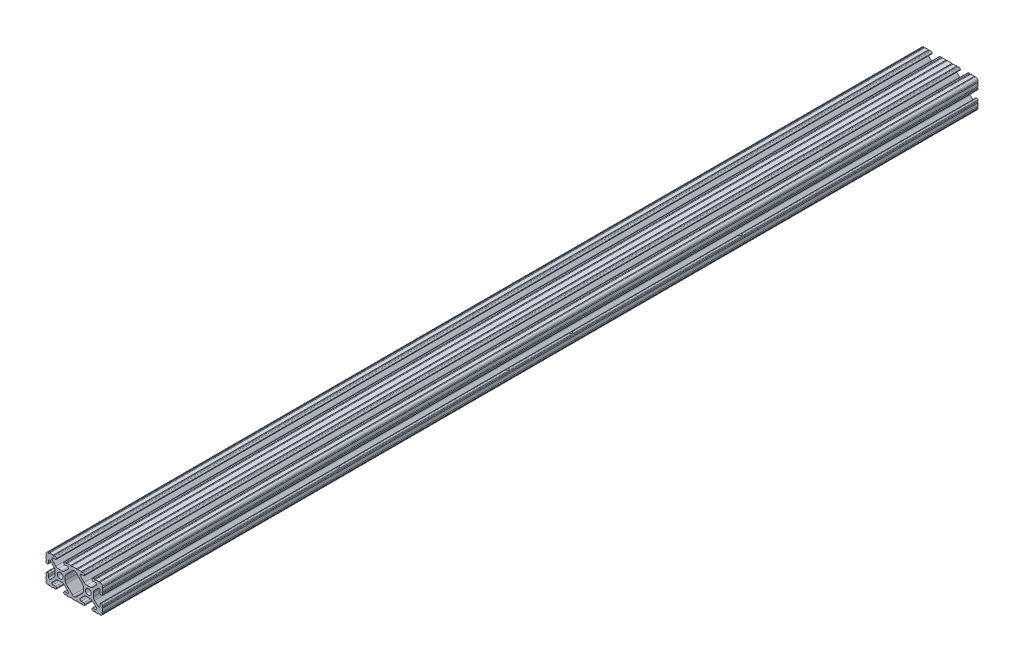
from build123d import *

# Parameters (mm, degrees)
SKETCH1_R               = 2.6035
BOSS_EXTRUDE1_DEPTH     = 393.7
CUT_EXTRUDE1_DEPTH      = 397.202554803
CUT_EXTRUDE1_DEPTH_BACK = 397.202554803
SKETCH2_R               = 3.5


with BuildPart() as part:
    # Sketch1 → Boss-Extrude1 (new, symmetric)
    with BuildSketch(Plane.XY):
        with BuildLine():
            Line((18.01710265, 12.7), (16.98745015, 12.7))
            ThreePointArc((16.98745015, 12.7), (16.245730386, 12.392769614), (15.9385, 11.65104985))
            Line((15.9385, 11.65104985), (15.9385, 11.53922))
            ThreePointArc((15.9385, 11.53922), (16.245750844, 10.797450844), (16.98752, 10.4902))
            Line((16.98752, 10.4902), (19.116384363, 10.4902))
            ThreePointArc((19.116384363, 10.4902), (20.052502933, 9.869096983), (19.844087081, 8.765172272))
            Line((19.844087081, 8.765172272), (16.618993479, 5.455112286))
            ThreePointArc((16.618993479, 5.455112286), (15.578994274, 4.745442459), (14.344932584, 4.4958))
            Line((14.344932584, 4.4958), (11.083317835, 4.4958))
            ThreePointArc((11.083317835, 4.4958), (9.854330953, 4.743306833), (8.816955189, 5.447238587))
            Line((8.816955189, 5.447238587), (5.564154119, 8.762652677))
            ThreePointArc((5.564154119, 8.762652677), (5.352591412, 9.867473037), (6.289393385, 10.4902))
            Line((6.289393385, 10.4902), (8.41248, 10.4902))
            ThreePointArc((8.41248, 10.4902), (9.154249156, 10.797450844), (9.4615, 11.53922))
            Line((9.4615, 11.53922), (9.4615, 11.65104985))
            ThreePointArc((9.4615, 11.65104985), (9.154269614, 12.392769614), (8.41254985, 12.7))
            Line((8.41254985, 12.7), (7.38288465, 12.7))
            ThreePointArc((7.38288465, 12.7), (6.87488465, 12.192), (6.36688465, 12.7))
            Line((6.36688465, 12.7), (3.14958095, 12.7))
            ThreePointArc((3.14958095, 12.7), (2.64158095, 12.192), (2.13358095, 12.7))
            Line((2.13358095, 12.7), (-2.13358095, 12.7))
            ThreePointArc((-2.13358095, 12.7), (-2.64158095, 12.192), (-3.14958095, 12.7))
            Line((-3.14958095, 12.7), (-6.36689735, 12.7))
            ThreePointArc((-6.36689735, 12.7), (-6.87489735, 12.192), (-7.38289735, 12.7))
            Line((-7.38289735, 12.7), (-8.41254985, 12.7))
            ThreePointArc((-8.41254985, 12.7), (-9.154269614, 12.392769614), (-9.4615, 11.65104985))
            Line((-9.4615, 11.65104985), (-9.4615, 11.53922))
            ThreePointArc((-9.4615, 11.53922), (-9.154249156, 10.797450844), (-8.41248, 10.4902))
            Line((-8.41248, 10.4902), (-6.283641037, 10.4902))
            ThreePointArc((-6.283641037, 10.4902), (-5.297291557, 9.829633109), (-5.532576693, 8.666071843))
            Line((-5.532576693, 8.666071843), (-8.809985098, 5.416263103))
            ThreePointArc((-8.809985098, 5.416263103), (-9.836720513, 4.734920264), (-11.045536121, 4.4958))
            Line((-11.045536121, 4.4958), (-14.354463879, 4.4958))
            ThreePointArc((-14.354463879, 4.4958), (-15.563279487, 4.734920264), (-16.590014902, 5.416263103))
            Line((-16.590014902, 5.416263103), (-19.867423307, 8.666071843))
            ThreePointArc((-19.867423307, 8.666071843), (-20.102708443, 9.829633109), (-19.116358963, 10.4902))
            Line((-19.116358963, 10.4902), (-16.98752, 10.4902))
            ThreePointArc((-16.98752, 10.4902), (-16.245750844, 10.797450844), (-15.9385, 11.53922))
            Line((-15.9385, 11.53922), (-15.9385, 11.65104985))
            ThreePointArc((-15.9385, 11.65104985), (-16.245730386, 12.392769614), (-16.98745015, 12.7))
            Line((-16.98745015, 12.7), (-18.01711535, 12.7))
            ThreePointArc((-18.01711535, 12.7), (-18.52511535, 12.192), (-19.03311535, 12.7))
            Line((-19.03311535, 12.7), (-22.2504, 12.7))
            ThreePointArc((-22.2504, 12.7), (-22.758323491, 12.192000006), (-23.266399977, 12.699846982))
            ThreePointArc((-23.266399977, 12.699846982), (-24.782522516, 12.082522516), (-25.399846982, 10.566399977))
            ThreePointArc((-25.399846982, 10.566399977), (-24.892000006, 10.058323491), (-25.4, 9.5504))
            Line((-25.4, 9.5504), (-25.4, 6.3330836))
            ThreePointArc((-25.4, 6.3330836), (-24.892, 5.8250836), (-25.4, 5.3170836))
            Line((-25.4, 5.3170836), (-25.4, 4.237520184))
            ThreePointArc((-25.4, 4.237520184), (-25.107393763, 3.531106237), (-24.400979816, 3.2385))
            Line((-24.400979816, 3.2385), (-24.23922, 3.2385))
            ThreePointArc((-24.23922, 3.2385), (-23.497450844, 3.545750844), (-23.1902, 4.28752))
            Line((-23.1902, 4.28752), (-23.1902, 6.334741132))
            ThreePointArc((-23.1902, 6.334741132), (-22.556026952, 7.286023527), (-21.434002553, 7.066535717))
            Line((-21.434002553, 7.066535717), (-18.147950853, 3.808156468))
            ThreePointArc((-18.147950853, 3.808156468), (-17.452759693, 2.774838327), (-17.208501877, 1.553619571))
            Line((-17.208501877, 1.553619571), (-17.208501877, -1.695179196))
            ThreePointArc((-17.208501877, -1.695179196), (-17.450738657, -2.911536421), (-18.140486065, -3.942289578))
            Line((-18.140486065, -3.942289578), (-21.431579576, -7.227386226))
            ThreePointArc((-21.431579576, -7.227386226), (-22.55444896, -7.449940594), (-23.1902, -6.498002195))
            Line((-23.1902, -6.498002195), (-23.1902, -4.28752))
            ThreePointArc((-23.1902, -4.28752), (-23.497450844, -3.545750844), (-24.23922, -3.2385))
            Line((-24.23922, -3.2385), (-24.35098, -3.2385))
            ThreePointArc((-24.35098, -3.2385), (-25.092749156, -3.545750844), (-25.4, -4.28752))
            Line((-25.4, -4.28752), (-25.4, -5.3171344))
            ThreePointArc((-25.4, -5.3171344), (-24.892, -5.8251344), (-25.4, -6.3331344))
            Line((-25.4, -6.3331344), (-25.4, -9.5504))
            ThreePointArc((-25.4, -9.5504), (-24.892000006, -10.058323491), (-25.399846982, -10.566399977))
            ThreePointArc((-25.399846982, -10.566399977), (-24.782522516, -12.082522516), (-23.266399977, -12.699846982))
            ThreePointArc((-23.266399977, -12.699846982), (-22.758323491, -12.192000006), (-22.2504, -12.7))
            Line((-22.2504, -12.7), (-19.03308995, -12.7))
            ThreePointArc((-19.03308995, -12.7), (-18.52508995, -12.192), (-18.01708995, -12.7))
            Line((-18.01708995, -12.7), (-16.9874692, -12.7))
            ThreePointArc((-16.9874692, -12.7), (-16.245700044, -12.392749156), (-15.9384492, -11.65098))
            Line((-15.9384492, -11.65098), (-15.9384492, -11.53922))
            ThreePointArc((-15.9384492, -11.53922), (-16.245700044, -10.797450844), (-16.9874692, -10.4902))
            Line((-16.9874692, -10.4902), (-19.116358963, -10.4902))
            ThreePointArc((-19.116358963, -10.4902), (-20.055197748, -9.862578342), (-19.834124023, -8.755124678))
            Line((-19.834124023, -8.755124678), (-16.49660751, -5.423689618))
            ThreePointArc((-16.49660751, -5.423689618), (-15.467274017, -4.736928798), (-14.253591699, -4.4958))
            Line((-14.253591699, -4.4958), (-11.146408301, -4.4958))
            ThreePointArc((-11.146408301, -4.4958), (-9.932725983, -4.736928798), (-8.90339249, -5.423689618))
            Line((-8.90339249, -5.423689618), (-5.565875977, -8.755124678))
            ThreePointArc((-5.565875977, -8.755124678), (-5.344802252, -9.862578342), (-6.283641037, -10.4902))
            Line((-6.283641037, -10.4902), (-8.4125308, -10.4902))
            ThreePointArc((-8.4125308, -10.4902), (-9.154299956, -10.797450844), (-9.4615508, -11.53922))
            Line((-9.4615508, -11.53922), (-9.4615508, -11.65098))
            ThreePointArc((-9.4615508, -11.65098), (-9.154299956, -12.392749156), (-8.4125308, -12.7))
            Line((-8.4125308, -12.7), (-7.38287195, -12.7))
            ThreePointArc((-7.38287195, -12.7), (-6.87487195, -12.192), (-6.36687195, -12.7))
            Line((-6.36687195, -12.7), (-3.14960635, -12.7))
            ThreePointArc((-3.14960635, -12.7), (-2.64160635, -12.192), (-2.13360635, -12.7))
            Line((-2.13360635, -12.7), (2.13360635, -12.7))
            ThreePointArc((2.13360635, -12.7), (2.64159365, -12.1920127), (3.14958095, -12.7))
            Line((3.14958095, -12.7), (6.36691005, -12.7))
            ThreePointArc((6.36691005, -12.7), (6.87491005, -12.192), (7.38291005, -12.7))
            Line((7.38291005, -12.7), (8.4125308, -12.7))
            ThreePointArc((8.4125308, -12.7), (9.154299956, -12.392749156), (9.4615508, -11.65098))
            Line((9.4615508, -11.65098), (9.4615508, -11.53922))
            ThreePointArc((9.4615508, -11.53922), (9.154299956, -10.797450844), (8.4125308, -10.4902))
            Line((8.4125308, -10.4902), (6.289393385, -10.4902))
            ThreePointArc((6.289393385, -10.4902), (5.231590322, -9.783049717), (5.480677245, -8.535265862))
            Line((5.480677245, -8.535265862), (8.597933595, -5.423689618))
            ThreePointArc((8.597933595, -5.423689618), (9.627267088, -4.736928798), (10.840949406, -4.4958))
            Line((10.840949406, -4.4958), (14.102564155, -4.4958))
            ThreePointArc((14.102564155, -4.4958), (15.215927525, -4.697410182), (16.187895372, -5.276636531))
            Line((16.187895372, -5.276636531), (19.868247549, -8.482246082))
            ThreePointArc((19.868247549, -8.482246082), (20.188435806, -9.746879864), (19.116384363, -10.4902))
            Line((19.116384363, -10.4902), (16.9874692, -10.4902))
            ThreePointArc((16.9874692, -10.4902), (16.245700044, -10.797450844), (15.9384492, -11.53922))
            Line((15.9384492, -11.53922), (15.9384492, -11.65098))
            ThreePointArc((15.9384492, -11.65098), (16.245700044, -12.392749156), (16.9874692, -12.7))
            Line((16.9874692, -12.7), (18.01710265, -12.7))
            ThreePointArc((18.01710265, -12.7), (18.52510265, -12.192), (19.03310265, -12.7))
            Line((19.03310265, -12.7), (22.2504, -12.7))
            ThreePointArc((22.2504, -12.7), (22.758323491, -12.192000006), (23.266399977, -12.699846982))
            ThreePointArc((23.266399977, -12.699846982), (24.782522516, -12.082522516), (25.399846982, -10.566399977))
            ThreePointArc((25.399846982, -10.566399977), (24.892000006, -10.058323492), (25.4, -9.550400001))
            Line((25.4, -9.550400001), (25.4, -6.333083592))
            ThreePointArc((25.4, -6.333083592), (24.892000001, -5.825083593), (25.4, -5.317083593))
            Line((25.4, -5.317083593), (25.4, -4.237520184))
            ThreePointArc((25.4, -4.237520184), (25.107393763, -3.531106237), (24.400979816, -3.2385))
            Line((24.400979816, -3.2385), (24.189220184, -3.2385))
            ThreePointArc((24.189220184, -3.2385), (23.482806237, -3.531106237), (23.1902, -4.237520184))
            Line((23.1902, -4.237520184), (23.1902, -6.155876159))
            ThreePointArc((23.1902, -6.155876159), (22.62232736, -7.038258539), (21.583974541, -6.886926384))
            Line((21.583974541, -6.886926384), (18.29817066, -4.024970844))
            ThreePointArc((18.29817066, -4.024970844), (17.493730985, -2.946044689), (17.208501877, -1.630807374))
            Line((17.208501877, -1.630807374), (17.208501877, 1.630807374))
            ThreePointArc((17.208501877, 1.630807374), (17.442348332, 2.82673414), (18.109440981, 3.846495088))
            Line((18.109440981, 3.846495088), (21.526346532, 7.353420386))
            ThreePointArc((21.526346532, 7.353420386), (22.585896263, 7.574939077), (23.1902, 6.676867167))
            Line((23.1902, 6.676867167), (23.1902, 4.237520184))
            ThreePointArc((23.1902, 4.237520184), (23.482806237, 3.531106237), (24.189220184, 3.2385))
            Line((24.189220184, 3.2385), (24.400979816, 3.2385))
            ThreePointArc((24.400979816, 3.2385), (25.107393763, 3.531106237), (25.4, 4.237520184))
            Line((25.4, 4.237520184), (25.4, 5.3170836))
            ThreePointArc((25.4, 5.3170836), (24.891949193, 5.825134407), (25.4, 6.333185215))
            Line((25.4, 6.333185215), (25.4, 9.550400015))
            ThreePointArc((25.4, 9.550400015), (24.892000013, 10.058323498), (25.399846982, 10.566399977))
            ThreePointArc((25.399846982, 10.566399977), (24.782522516, 12.082522516), (23.266399977, 12.699846982))
            ThreePointArc((23.266399977, 12.699846982), (22.758323491, 12.192000006), (22.2504, 12.7))
            Line((22.2504, 12.7), (19.03310265, 12.7))
            ThreePointArc((19.03310265, 12.7), (18.52510265, 12.192), (18.01710265, 12.7))
        make_face()
        with Locations((-12.7, 0)):
            Circle(SKETCH1_R, mode=Mode.SUBTRACT)
        with Locations((12.7, 0)):
            Circle(SKETCH1_R, mode=Mode.SUBTRACT)
        with BuildLine():
            Line((-7.259513935, -3.869413038), (-1.545748891, -9.572766749))
            ThreePointArc((-1.545748891, -9.572766749), (-1.035199478, -9.913400116), (-0.433213048, -10.033))
            Line((-0.433213048, -10.033), (0.433213048, -10.033))
            ThreePointArc((0.433213048, -10.033), (1.035199478, -9.913400116), (1.545748891, -9.572766749))
            Line((1.545748891, -9.572766749), (7.259513935, -3.869413038))
            ThreePointArc((7.259513935, -3.869413038), (7.949261343, -2.838659881), (8.191498123, -1.622302656))
            Line((8.191498123, -1.622302656), (8.191498123, 1.622302656))
            ThreePointArc((8.191498123, 1.622302656), (7.955573352, 2.823327967), (7.282860769, 3.845864069))
            Line((7.282860769, 3.845864069), (1.675572808, 9.561086461))
            ThreePointArc((1.675572808, 9.561086461), (1.161034429, 9.910236611), (0.551456936, 10.033))
            Line((0.551456936, 10.033), (-0.395199982, 10.033))
            ThreePointArc((-0.395199982, 10.033), (-0.994772524, 9.914396349), (-1.50403329, 9.576450301))
            Line((-1.50403329, 9.576450301), (-7.252049147, 3.876839553))
            ThreePointArc((-7.252049147, 3.876839553), (-7.947240307, 2.843521412), (-8.191498123, 1.622302656))
            Line((-8.191498123, 1.622302656), (-8.191498123, -1.622302656))
            ThreePointArc((-8.191498123, -1.622302656), (-7.949261343, -2.838659881), (-7.259513935, -3.869413038))
        make_face(mode=Mode.SUBTRACT)
    extrude(amount=BOSS_EXTRUDE1_DEPTH, both=True)

    # Sketch2 → Cut-Extrude1 (cut, two sides: drawn at the far end of the back side and taken through both)
    with BuildSketch(Plane(origin=(17.208501877, 0, 0), x_dir=(0, 0, -1), z_dir=(1, 0, 0)).offset(-CUT_EXTRUDE1_DEPTH_BACK)):
        with Locations(Location((28.57, 0, 0), (0, 0, 27.771395665))):
            Circle(SKETCH2_R)
        with Locations(Location((-28.57, 0, 0), (0, 0, 27.771395665))):
            Circle(SKETCH2_R)
        with Locations(Location((180.97, 0, 0), (0, 0, 27.771395665))):
            Circle(SKETCH2_R)
        with Locations(Location((-180.97, 0, 0), (0, 0, 27.771395665))):
            Circle(SKETCH2_R)
    extrude(amount=CUT_EXTRUDE1_DEPTH + CUT_EXTRUDE1_DEPTH_BACK, mode=Mode.SUBTRACT)


solid = part.part
